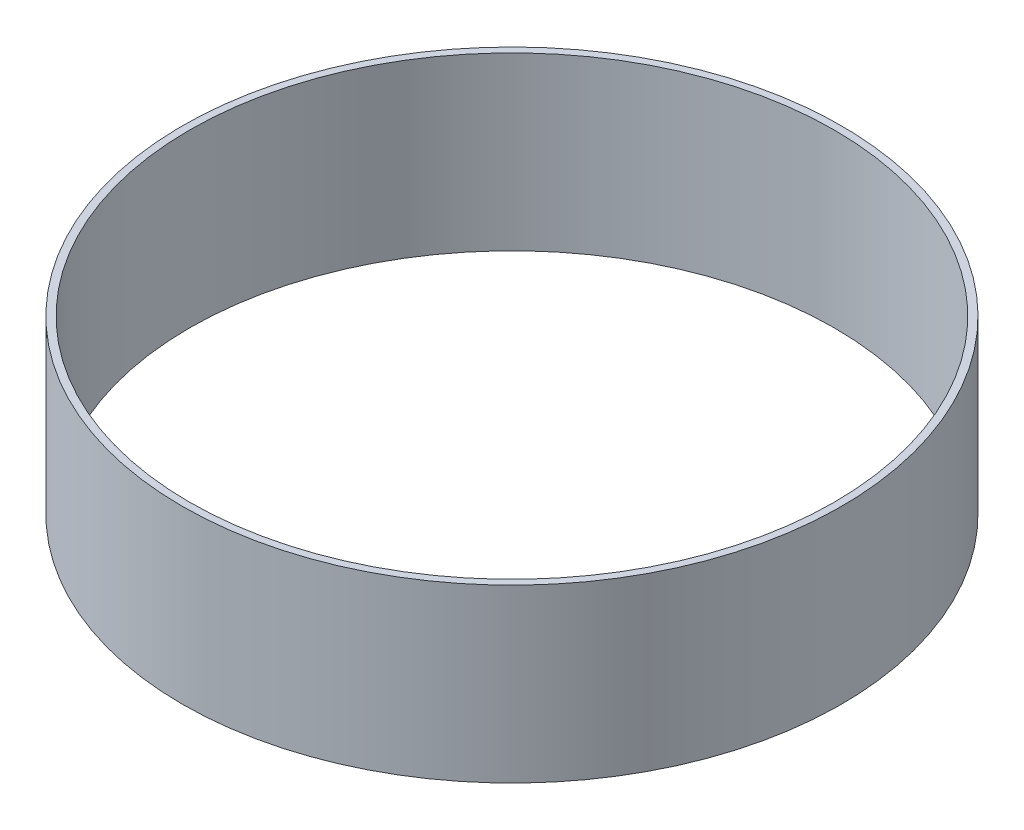
from build123d import *

# Parameters (mm, degrees)
SKETCH1_R           = 68.5
SKETCH1_R_2         = 67
BOSS_EXTRUDE1_DEPTH = 35.625


with BuildPart() as part:
    # Sketch1 → Boss-Extrude1 (new body)
    with BuildSketch(Plane(origin=(0, 0, 0), x_dir=(1, 0, 0), z_dir=(0, 1, 0))):
        with Locations(Location((-51.437551504, 94.672983018, 0), (0, 0, 270))):
            Circle(SKETCH1_R)
        with Locations(Location((-51.437551504, 94.672983018, 0), (0, 0, 270))):
            Circle(SKETCH1_R_2, mode=Mode.SUBTRACT)
    extrude(amount=BOSS_EXTRUDE1_DEPTH)


solid = part.part
